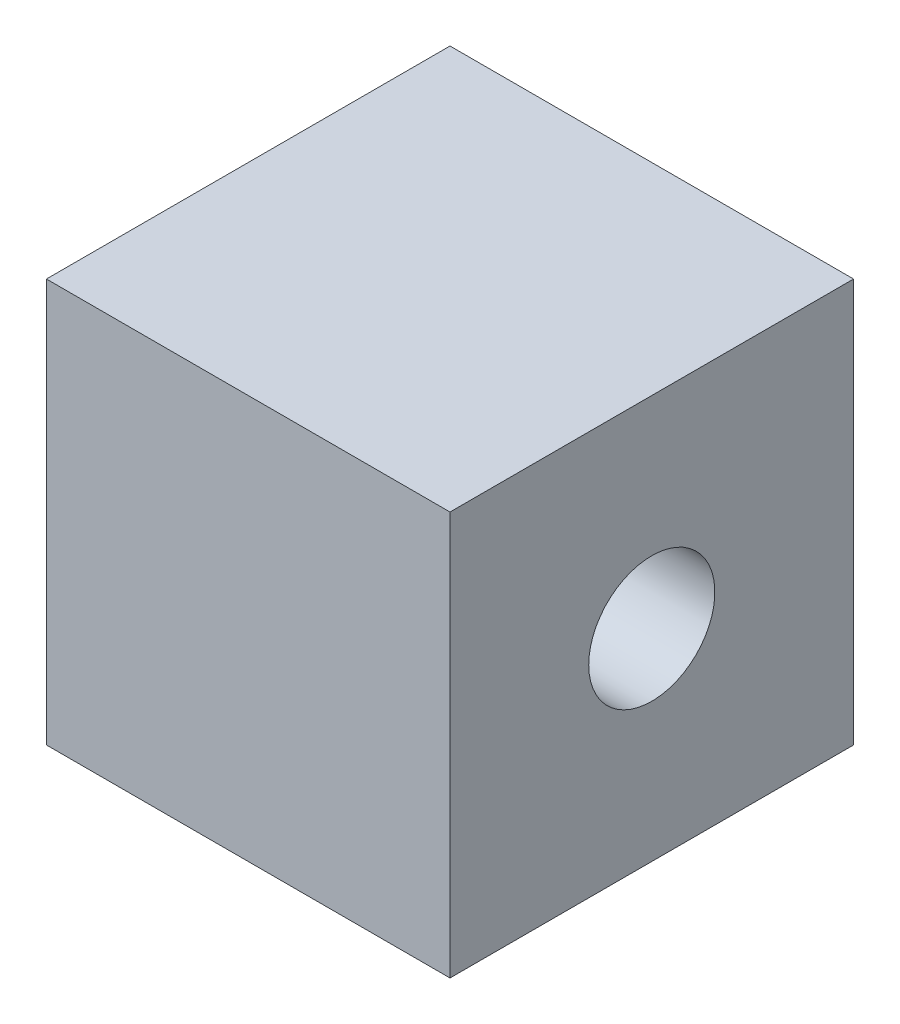
from build123d import *

# Parameters (mm, degrees)
SKETCH_1_W          = 8
SKETCH_1_H          = 8
EXTRUDE_1_DEPTH     = 8
SKETCH_2_R          = 1.25
CUT_EXTRUDE_1_DEPTH = 8


with BuildPart() as part:
    # 草图1 → 凸台-拉伸1 (new body)
    with BuildSketch(Plane(origin=(0, 0, 0), x_dir=(1, 0, 0), z_dir=(0, 1, 0))):
        with Locations((4, 4)):
            Rectangle(SKETCH_1_W, SKETCH_1_H)
    extrude(amount=EXTRUDE_1_DEPTH)

    # 草图2 → 切除-拉伸1 (cut)
    with BuildSketch(Plane.ZY):
        with Locations((-4, 4)):
            Circle(SKETCH_2_R)
    extrude(amount=-CUT_EXTRUDE_1_DEPTH, mode=Mode.SUBTRACT)


solid = part.part
